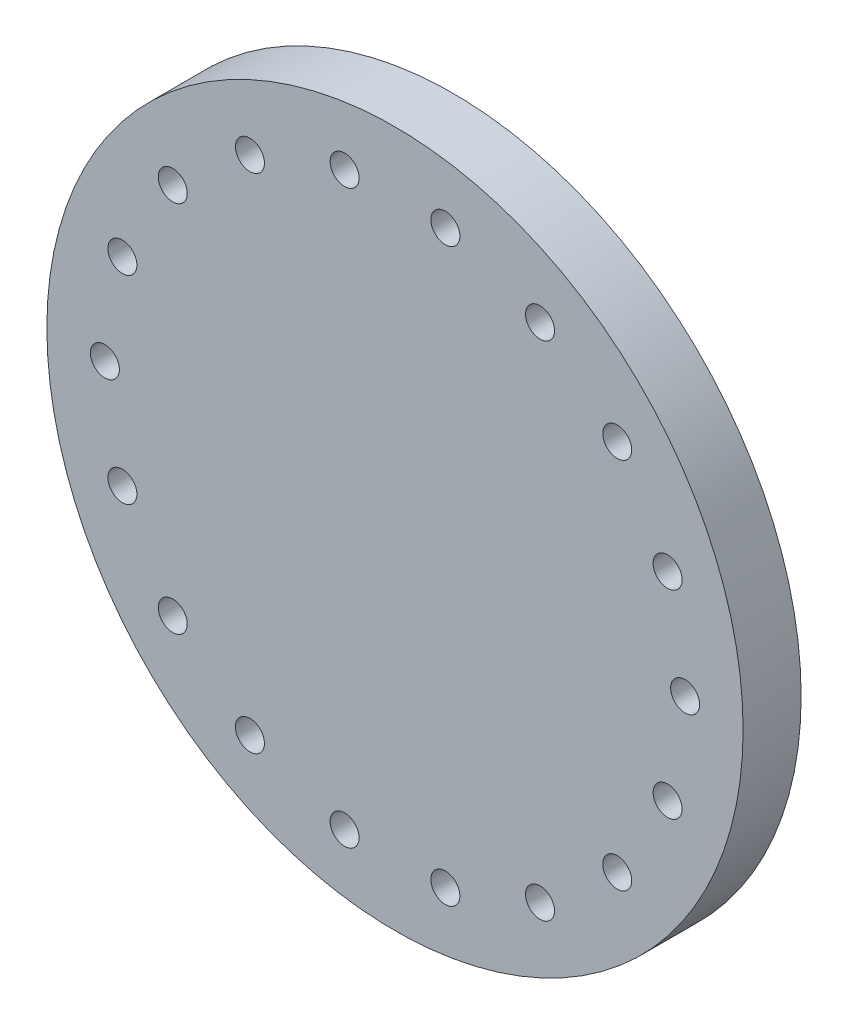
from build123d import *

# Parameters (mm, degrees)
SKETCH1_R           = 76.2
SKETCH1_R_2         = 3.175
BOSS_EXTRUDE1_DEPTH = 12.7


with BuildPart() as part:
    # Sketch1 → Boss-Extrude1 (new body)
    with BuildSketch(Plane.XY):
        Circle(SKETCH1_R)
        with Locations((-63.5, 0)):
            Circle(SKETCH1_R_2, mode=Mode.SUBTRACT)
        with Locations((-59.67048142, 21.718279101)):
            Circle(SKETCH1_R_2, mode=Mode.SUBTRACT)
        with Locations((-48.643822138, 40.817013215)):
            Circle(SKETCH1_R_2, mode=Mode.SUBTRACT)
        with Locations((-31.75, 54.99261314)):
            Circle(SKETCH1_R_2, mode=Mode.SUBTRACT)
        with Locations((-11.026659282, 62.535292316)):
            Circle(SKETCH1_R_2, mode=Mode.SUBTRACT)
        with Locations((11.026659282, 62.535292316)):
            Circle(SKETCH1_R_2, mode=Mode.SUBTRACT)
        with Locations((31.75, 54.99261314)):
            Circle(SKETCH1_R_2, mode=Mode.SUBTRACT)
        with Locations((48.643822138, 40.817013215)):
            Circle(SKETCH1_R_2, mode=Mode.SUBTRACT)
        with Locations((59.67048142, 21.718279101)):
            Circle(SKETCH1_R_2, mode=Mode.SUBTRACT)
        with Locations((63.5, 0)):
            Circle(SKETCH1_R_2, mode=Mode.SUBTRACT)
        with Locations((59.67048142, -21.718279101)):
            Circle(SKETCH1_R_2, mode=Mode.SUBTRACT)
        with Locations((48.643822138, -40.817013215)):
            Circle(SKETCH1_R_2, mode=Mode.SUBTRACT)
        with Locations((31.75, -54.99261314)):
            Circle(SKETCH1_R_2, mode=Mode.SUBTRACT)
        with Locations((11.026659282, -62.535292316)):
            Circle(SKETCH1_R_2, mode=Mode.SUBTRACT)
        with Locations((-11.026659282, -62.535292316)):
            Circle(SKETCH1_R_2, mode=Mode.SUBTRACT)
        with Locations((-31.75, -54.99261314)):
            Circle(SKETCH1_R_2, mode=Mode.SUBTRACT)
        with Locations((-48.643822138, -40.817013215)):
            Circle(SKETCH1_R_2, mode=Mode.SUBTRACT)
        with Locations((-59.67048142, -21.718279101)):
            Circle(SKETCH1_R_2, mode=Mode.SUBTRACT)
    extrude(amount=BOSS_EXTRUDE1_DEPTH)


solid = part.part
